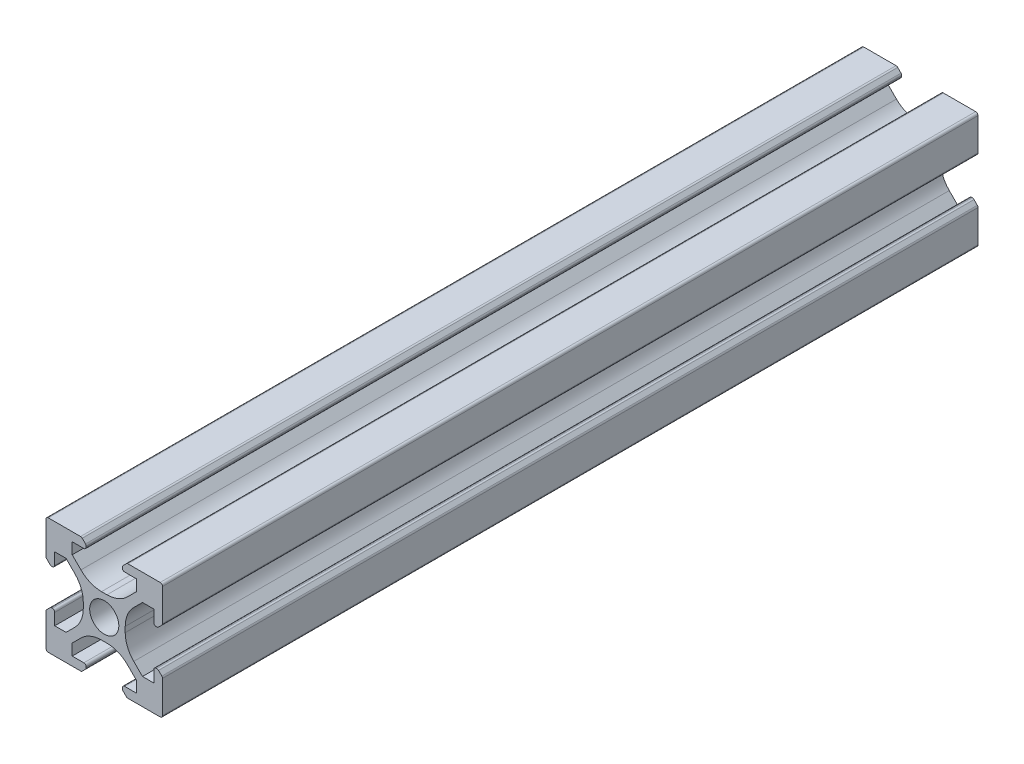
from build123d import *

# Parameters (mm, degrees)
RESSALTO_EXTRUS_O1_DEPTH = 140
PADR_OCIRCULAR1_COUNT    = 4
FILETE1_R                = 0.4


with BuildPart() as part:
    # Esboço1 → Ressalto-extrusão1 (new body)
    with BuildSketch(Plane.XY):
        with BuildLine():
            ThreePointArc((-9.317157288, 3.217157288), (-9.187387948, 3.130448187), (-9.034314575, 3.1))
            Line((-9.034314575, 3.1), (-8.9, 3.1))
            ThreePointArc((-8.9, 3.1), (-8.617157288, 3.217157288), (-8.5, 3.5))
            Line((-8.5, 3.5), (-8.5, 5.5))
            Line((-8.5, 5.5), (-6.560660172, 5.5))
            Line((-6.560660172, 5.5), (-5.064466094, 4.003805922))
            ThreePointArc((-5.064466094, 4.003805922), (-3.980602337, 2.381689178), (-3.6, 0.468272016))
            Line((-3.6, 0.468272016), (-3.6, 0))
            Line((-3.6, 0), (-2.5, 0))
            ThreePointArc((-2.5, 0), (-1.767766953, 1.767766953), (0, 2.5))
            Line((0, 2.5), (0, 3.6))
            Line((0, 3.6), (-0.468272016, 3.6))
            ThreePointArc((-0.468272016, 3.6), (-2.381689178, 3.980602337), (-4.003805922, 5.064466094))
            Line((-4.003805922, 5.064466094), (-5.5, 6.560660172))
            Line((-5.5, 6.560660172), (-5.5, 8.5))
            Line((-5.5, 8.5), (-3.5, 8.5))
            ThreePointArc((-3.5, 8.5), (-3.217157288, 8.617157288), (-3.1, 8.9))
            Line((-3.1, 8.9), (-3.1, 9.034314575))
            ThreePointArc((-3.1, 9.034314575), (-3.130448187, 9.187387948), (-3.217157288, 9.317157288))
            Line((-3.217157288, 9.317157288), (-3.782842712, 9.882842712))
            ThreePointArc((-3.782842712, 9.882842712), (-3.912612052, 9.969551813), (-4.065685425, 10))
            Line((-4.065685425, 10), (-10, 10))
            Line((-10, 10), (-10, 4.065685425))
            ThreePointArc((-10, 4.065685425), (-9.969551813, 3.912612052), (-9.882842712, 3.782842712))
            Line((-9.882842712, 3.782842712), (-9.317157288, 3.217157288))
        make_face()
    ressalto_extrus_o1 = extrude(amount=RESSALTO_EXTRUS_O1_DEPTH)

    # PadrãoCircular1: Ressalto-extrusão1 ×4 about axis
    padr_ocircular1_axis = Axis((0, 0, 0), (0, 0, 1))
    for i in range(1, PADR_OCIRCULAR1_COUNT):
        add(ressalto_extrus_o1.rotate(padr_ocircular1_axis, i * 360 / PADR_OCIRCULAR1_COUNT))

    # Filete1
    filete1_edges = [part.edges().sort_by_distance(p)[0] for p in [
        (10, -10, 70),
        (10, 10, 70),
        (-10, 10, 70),
        (-10, -10, 70),
    ]]
    fillet(filete1_edges, radius=FILETE1_R)


solid = part.part
